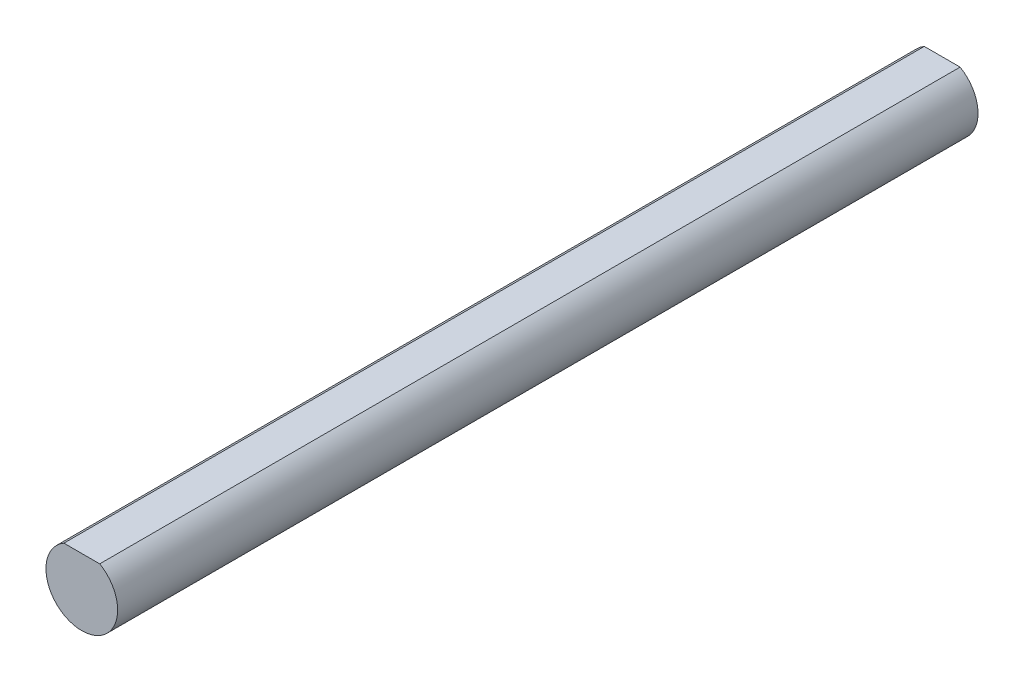
from build123d import *

# Parameters (mm, degrees)
BOSS_EXTRUDE1_DEPTH = 38.1


with BuildPart() as part:
    # Sketch1 → Boss-Extrude1 (new, symmetric)
    with BuildSketch(Plane.XY):
        with BuildLine():
            Line((-1.5875, 2.749630657), (1.5875, 2.749630657))
            ThreePointArc((1.5875, 2.749630657), (0, -3.175), (-1.5875, 2.749630657))
        make_face()
    extrude(amount=BOSS_EXTRUDE1_DEPTH, both=True)


solid = part.part
